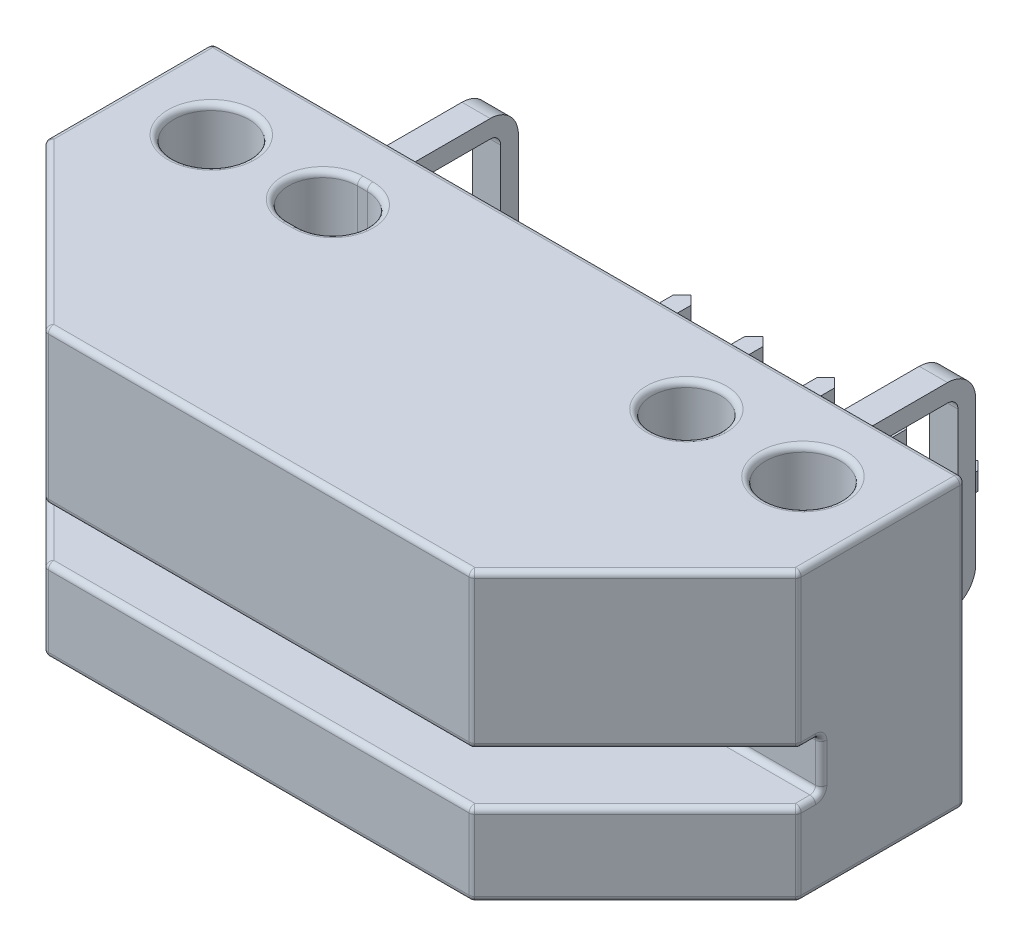
from build123d import *

# Parameters (mm, degrees)
BOSS_EXTRUDE1_DEPTH = 10.16
SKETCH2_W           = 26.67
SKETCH2_H           = 6.59
CUT_EXTRUDE1_DEPTH  = 0.89
BOSS_EXTRUDE2_DEPTH = 0.63
LPATTERN1_COUNT     = 3
LPATTERN1_PITCH     = 2.54
LPATTERN1_COL_COUNT = 3
LPATTERN1_COL_PITCH = 2.54
SKETCH4_R           = 1.335
CUT_EXTRUDE2_DEPTH  = 24.417308236
SKETCH5_R           = 1.22
CUT_EXTRUDE3_DEPTH  = 2.16
SKETCH6_W           = 1
SKETCH6_H           = 0.63
LPATTERN3_COUNT     = 2
LPATTERN3_PITCH     = 16.2
SKETCH8_R           = 1.22
CUT_EXTRUDE4_DEPTH  = 2.16
FILLET2_R           = 0.2
FILLET3_R           = 0.2


with BuildPart() as part:
    # Sketch1 → Boss-Extrude1 (new body)
    with BuildSketch(Plane(origin=(0, 0, 0), x_dir=(1, 0, 0), z_dir=(0, 1, 0))):
        Polygon((-13.335, 7.65), (13.335, 7.65), (13.335, 1.75), (7.535, -4.05), (-7.535, -4.05), (-13.335, 1.75), align=None)
    extrude(amount=BOSS_EXTRUDE1_DEPTH)

    # Sketch2 → Cut-Extrude1 (cut, symmetric)
    with BuildSketch(Plane(origin=(0, 3.81, 0), x_dir=(1, 0, 0), z_dir=(0, 1, 0))):
        with Locations((0, -0.755)):
            Rectangle(SKETCH2_W, SKETCH2_H)
    extrude(amount=CUT_EXTRUDE1_DEPTH, both=True, mode=Mode.SUBTRACT)

    # Sketch3 → Boss-Extrude2 (add)
    with BuildSketch(Plane(origin=(0, 1.52, 0), x_dir=(1, 0, 0), z_dir=(0, 1, 0))):
        Polygon((-0.65, 7.65), (-0.65, 9.115), (-0.315, 9.45), (-0.315, 16.035), (0, 16.35), (0.315, 16.035), (0.315, 9.45), (0.65, 9.115), (0.65, 7.65), align=None)
    boss_extrude2 = extrude(amount=BOSS_EXTRUDE2_DEPTH)

    # LPattern1: Boss-Extrude2 ×3
    with Locations(*[(i * LPATTERN1_PITCH, 0, 0) for i in range(1, LPATTERN1_COUNT)]):
        add(boss_extrude2)

    # LPattern1 col: Boss-Extrude2 ×3
    with Locations(*[(-i * LPATTERN1_COL_PITCH, 0, 0) for i in range(1, LPATTERN1_COL_COUNT)]):
        add(boss_extrude2)

    # Sketch4 → Cut-Extrude2 (cut, through all)
    with BuildSketch(Plane.XZ):
        with Locations(Location((10.48, -4.75, 0), (0, 0, 270))):
            Circle(SKETCH4_R)
        with Locations(Location((-10.48, -4.75, 0), (0, 0, 270))):
            Circle(SKETCH4_R)
    extrude(amount=-CUT_EXTRUDE2_DEPTH, mode=Mode.SUBTRACT)

    # Sketch5 → Cut-Extrude3 (cut)
    with BuildSketch(Plane.XZ):
        with Locations(Location((8.64, 0, 0), (0, 0, 270))):
            Circle(SKETCH5_R)
        with BuildLine():
            Line((-8.455, -1.22), (-8.805, -1.22))
            ThreePointArc((-8.805, -1.22), (-10.025, 0), (-8.805, 1.22))
            Line((-8.805, 1.22), (-8.455, 1.22))
            ThreePointArc((-8.455, 1.22), (-7.235, 0), (-8.455, -1.22))
        make_face()
    extrude(amount=-CUT_EXTRUDE3_DEPTH, mode=Mode.SUBTRACT)

    # Sweep1: sweep along a path in Sketch7
    with BuildLine(Plane(origin=(-7.6, 0, 0), x_dir=(0, 0, -1), z_dir=(1, 0, 0))) as sweep1_path:
        Line((7.65, 1.52), (11.75, 1.52))
        ThreePointArc((11.75, 1.52), (12.457106781, 1.812893219), (12.75, 2.52))
        Line((12.75, 2.52), (12.75, 7.6))
        ThreePointArc((12.75, 7.6), (12.457106781, 8.307106781), (11.75, 8.6))
        Line((11.75, 8.6), (7.65, 8.6))
    # Sketch6 → Sweep1 (sweep)
    with BuildSketch(Plane(origin=(0, 0, -7.65), x_dir=(-1, 0, 0), z_dir=(0, 0, -1))):
        with Locations((8.1, 1.835)):
            Rectangle(SKETCH6_W, SKETCH6_H)
    sweep1 = sweep(path=sweep1_path.line)

    # LPattern3: Sweep1 ×2
    with Locations(*[(i * LPATTERN3_PITCH, 0, 0) for i in range(1, LPATTERN3_COUNT)]):
        add(sweep1)

    # Sketch8 → Cut-Extrude4 (cut)
    with BuildSketch(Plane(origin=(0, 10.16, 0), x_dir=(1, 0, 0), z_dir=(0, 1, 0))):
        with Locations(Location((6.35, 4.75, 0), (0, 0, 270))):
            Circle(SKETCH8_R)
        with BuildLine():
            Line((-6.175, 5.97), (-6.525, 5.97))
            ThreePointArc((-6.525, 5.97), (-7.745, 4.75), (-6.525, 3.53))
            Line((-6.525, 3.53), (-6.175, 3.53))
            ThreePointArc((-6.175, 3.53), (-4.955, 4.75), (-6.175, 5.97))
        make_face()
    extrude(amount=-CUT_EXTRUDE4_DEPTH, mode=Mode.SUBTRACT)

    # Fillet2
    fillet2_edges = [part.edges().sort_by_distance(p)[0] for p in [
        (0, 10.16, 4.05),
        (-13.335, 5.08, -7.65),
        (13.335, 5.08, -7.65),
        (13.335, 7.43, -1.75),
        (7.535, 7.43, 4.05),
        (-7.535, 7.43, 4.05),
        (-13.335, 7.43, -1.75),
        (10.435, 10.16, 1.15),
        (13.335, 10.16, -4.7),
        (13.335, 1.46, -1.75),
        (13.335, 4.7, -2.145),
        (0, 10.16, -7.65),
        (13.335, 2.92, -2.145),
        (7.535, 1.46, 4.05),
        (-7.535, 1.46, 4.05),
        (-13.335, 1.46, -1.75),
        (-13.335, 2.92, -2.145),
        (13.335, 3.81, -2.54),
        (0, 2.92, 4.05),
        (-10.435, 2.92, 1.15),
        (-13.335, 4.7, -2.145),
        (-10.435, 4.7, 1.15),
        (0, 4.7, 4.05),
        (10.435, 4.7, 1.15),
        (0, 4.7, -2.54),
        (0, 2.92, -2.54),
        (-13.335, 3.81, -2.54),
        (10.435, 2.92, 1.15),
        (-13.335, 10.16, -4.7),
        (0, 0, -7.65),
        (13.335, 0, -4.7),
        (10.435, 0, 1.15),
        (-10.435, 10.16, 1.15),
        (0, 0, 4.05),
        (-10.435, 0, 1.15),
        (-13.335, 0, -4.7),
    ]]
    fillet(fillet2_edges, radius=FILLET2_R)

    # Fillet3
    fillet3_edges = [part.edges().sort_by_distance(p)[0] for p in [
        (10.48, 10.16, -3.415),
        (10.48, 0, -3.415),
        (-10.48, 10.16, -3.415),
        (-10.48, 0, -3.415),
        (8.64, 0, 1.22),
        (-7.235, 0, 0),
        (-8.63, 0, 1.22),
        (-10.025, 0, 0),
        (-8.63, 0, -1.22),
        (6.35, 10.16, -5.97),
        (-4.955, 10.16, -4.75),
        (-6.35, 10.16, -5.97),
        (-7.745, 10.16, -4.75),
        (-6.35, 10.16, -3.53),
    ]]
    fillet(fillet3_edges, radius=FILLET3_R)


solid = part.part
